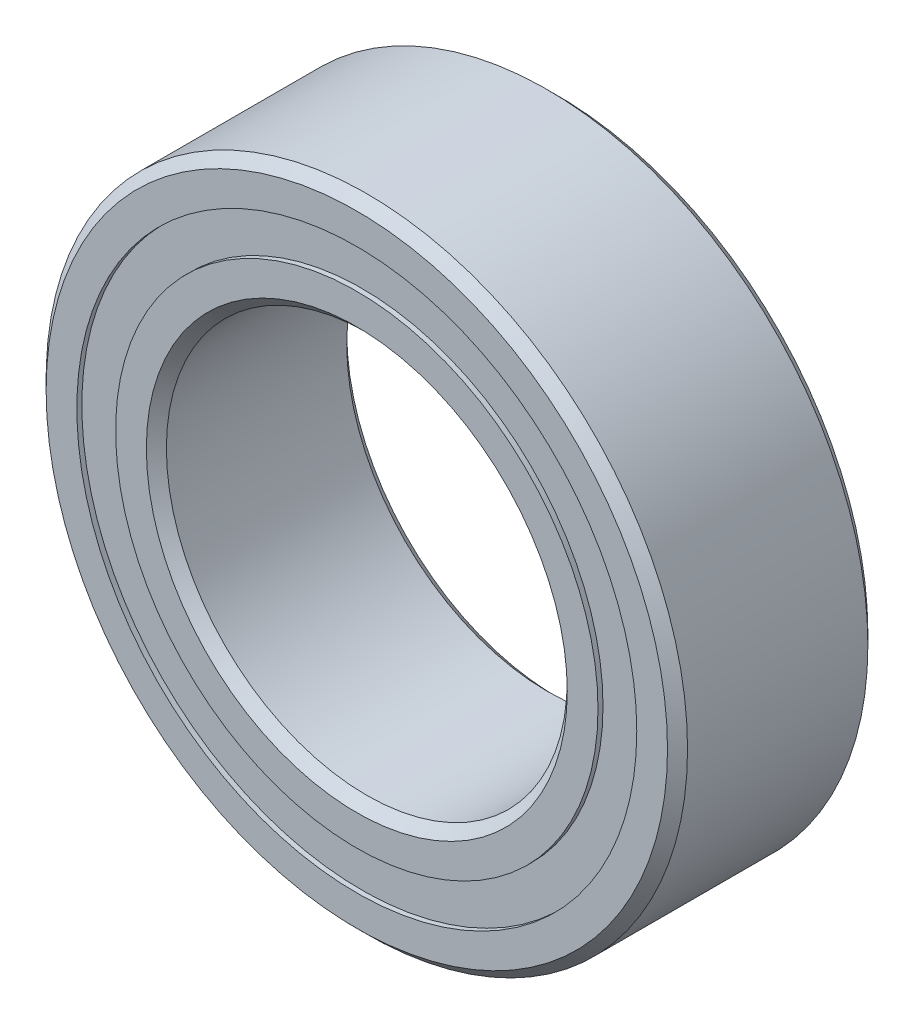
from build123d import *

# Parameters (mm, degrees)
CIRPATTERN1_COUNT = 16
SKETCH5_W         = 0.922957025
SKETCH5_H         = 0.767694066


with BuildPart() as part:
    # Sketch1 → Revolve1 (revolve)
    with BuildSketch(Plane(origin=(0, 0, 0), x_dir=(0, 0, -1), z_dir=(1, 0, 0))):
        with BuildLine():
            Line((1.785366, 6.35), (-1.785366, 6.35))
            Line((-1.785366, 6.35), (-1.98374, 6.151626))
            Line((-1.98374, 6.151626), (-1.98374, 5.543222033))
            Line((-1.98374, 5.543222033), (-0.881662222, 5.543222033))
            ThreePointArc((-0.881662222, 5.543222033), (0, 6.120970975), (0.881662222, 5.543222033))
            Line((0.881662222, 5.543222033), (1.98374, 5.543222033))
            Line((1.98374, 5.543222033), (1.98374, 6.151626))
            Line((1.98374, 6.151626), (1.785366, 6.35))
        make_face()
    revolve(axis=Axis((0, 0, 1.98374), (0, 0, -1)))


with BuildPart() as body_2:
    # Sketch3 → Revolve3 (revolve)
    with BuildSketch(Plane(origin=(0, 0, 0), x_dir=(0, 0, -1), z_dir=(1, 0, 0))):
        with BuildLine():
            Line((-0.881662222, 4.775527967), (-1.98374, 4.775527967))
            Line((-1.98374, 4.775527967), (-1.98374, 4.167124))
            Line((-1.98374, 4.167124), (-1.785366, 3.96875))
            Line((-1.785366, 3.96875), (1.785366, 3.96875))
            Line((1.785366, 3.96875), (1.98374, 4.167124))
            Line((1.98374, 4.167124), (1.98374, 4.775527967))
            Line((1.98374, 4.775527967), (0.881662222, 4.775527967))
            ThreePointArc((0.881662222, 4.775527967), (0, 4.197779025), (-0.881662222, 4.775527967))
        make_face()
    revolve(axis=Axis((0, 0, 1.98374), (0, 0, -1)))


with BuildPart() as body_3:
    # Sketch4 → Revolve4 (revolve)
    with BuildSketch(Plane(origin=(0, 0, 0), x_dir=(0, 0, -1), z_dir=(1, 0, 0))):
        with BuildLine():
            Line((-0.961595975, 5.159375), (0.961595975, 5.159375))
            ThreePointArc((0.961595975, 5.159375), (0, 6.120970975), (-0.961595975, 5.159375))
        make_face()
    revolve(axis=Axis((0, 5.159375, 0.961595975), (0, 0, -1)))


with BuildPart() as cirpattern1_1:
    # CirPattern1: pattern copy
    add(body_3.part.rotate(Axis((0, 0, -1.98374), (0, 0, 1)), 1 * 360 / CIRPATTERN1_COUNT))


with BuildPart() as cirpattern1_2:
    # CirPattern1: pattern copy
    add(body_3.part.rotate(Axis((0, 0, -1.98374), (0, 0, 1)), 2 * 360 / CIRPATTERN1_COUNT))


with BuildPart() as cirpattern1_3:
    # CirPattern1: pattern copy
    add(body_3.part.rotate(Axis((0, 0, -1.98374), (0, 0, 1)), 3 * 360 / CIRPATTERN1_COUNT))


with BuildPart() as cirpattern1_4:
    # CirPattern1: pattern copy
    add(body_3.part.rotate(Axis((0, 0, -1.98374), (0, 0, 1)), 4 * 360 / CIRPATTERN1_COUNT))


with BuildPart() as cirpattern1_5:
    # CirPattern1: pattern copy
    add(body_3.part.rotate(Axis((0, 0, -1.98374), (0, 0, 1)), 5 * 360 / CIRPATTERN1_COUNT))


with BuildPart() as cirpattern1_6:
    # CirPattern1: pattern copy
    add(body_3.part.rotate(Axis((0, 0, -1.98374), (0, 0, 1)), 6 * 360 / CIRPATTERN1_COUNT))


with BuildPart() as cirpattern1_7:
    # CirPattern1: pattern copy
    add(body_3.part.rotate(Axis((0, 0, -1.98374), (0, 0, 1)), 7 * 360 / CIRPATTERN1_COUNT))


with BuildPart() as cirpattern1_8:
    # CirPattern1: pattern copy
    add(body_3.part.rotate(Axis((0, 0, -1.98374), (0, 0, 1)), 8 * 360 / CIRPATTERN1_COUNT))


with BuildPart() as cirpattern1_9:
    # CirPattern1: pattern copy
    add(body_3.part.rotate(Axis((0, 0, -1.98374), (0, 0, 1)), 9 * 360 / CIRPATTERN1_COUNT))


with BuildPart() as cirpattern1_10:
    # CirPattern1: pattern copy
    add(body_3.part.rotate(Axis((0, 0, -1.98374), (0, 0, 1)), 10 * 360 / CIRPATTERN1_COUNT))


with BuildPart() as cirpattern1_11:
    # CirPattern1: pattern copy
    add(body_3.part.rotate(Axis((0, 0, -1.98374), (0, 0, 1)), 11 * 360 / CIRPATTERN1_COUNT))


with BuildPart() as cirpattern1_12:
    # CirPattern1: pattern copy
    add(body_3.part.rotate(Axis((0, 0, -1.98374), (0, 0, 1)), 12 * 360 / CIRPATTERN1_COUNT))


with BuildPart() as cirpattern1_13:
    # CirPattern1: pattern copy
    add(body_3.part.rotate(Axis((0, 0, -1.98374), (0, 0, 1)), 13 * 360 / CIRPATTERN1_COUNT))


with BuildPart() as cirpattern1_14:
    # CirPattern1: pattern copy
    add(body_3.part.rotate(Axis((0, 0, -1.98374), (0, 0, 1)), 14 * 360 / CIRPATTERN1_COUNT))


with BuildPart() as cirpattern1_15:
    # CirPattern1: pattern copy
    add(body_3.part.rotate(Axis((0, 0, -1.98374), (0, 0, 1)), 15 * 360 / CIRPATTERN1_COUNT))


with BuildPart() as body_19:
    # Sketch5 → Revolve5 (revolve)
    with BuildSketch(Plane(origin=(0, 0, 0), x_dir=(0, 0, -1), z_dir=(1, 0, 0))):
        with Locations((-1.423074488, 5.159375)):
            Rectangle(SKETCH5_W, SKETCH5_H)
        with Locations((1.423074488, 5.159375)):
            Rectangle(SKETCH5_W, SKETCH5_H)
    revolve(axis=Axis((0, 0, 1.98374), (0, 0, -1)))


solid = Compound([part.part, body_2.part, body_3.part, cirpattern1_1.part, cirpattern1_2.part, cirpattern1_3.part, cirpattern1_4.part, cirpattern1_5.part, cirpattern1_6.part, cirpattern1_7.part, cirpattern1_8.part, cirpattern1_9.part, cirpattern1_10.part, cirpattern1_11.part, cirpattern1_12.part, cirpattern1_13.part, cirpattern1_14.part, cirpattern1_15.part, body_19.part])
